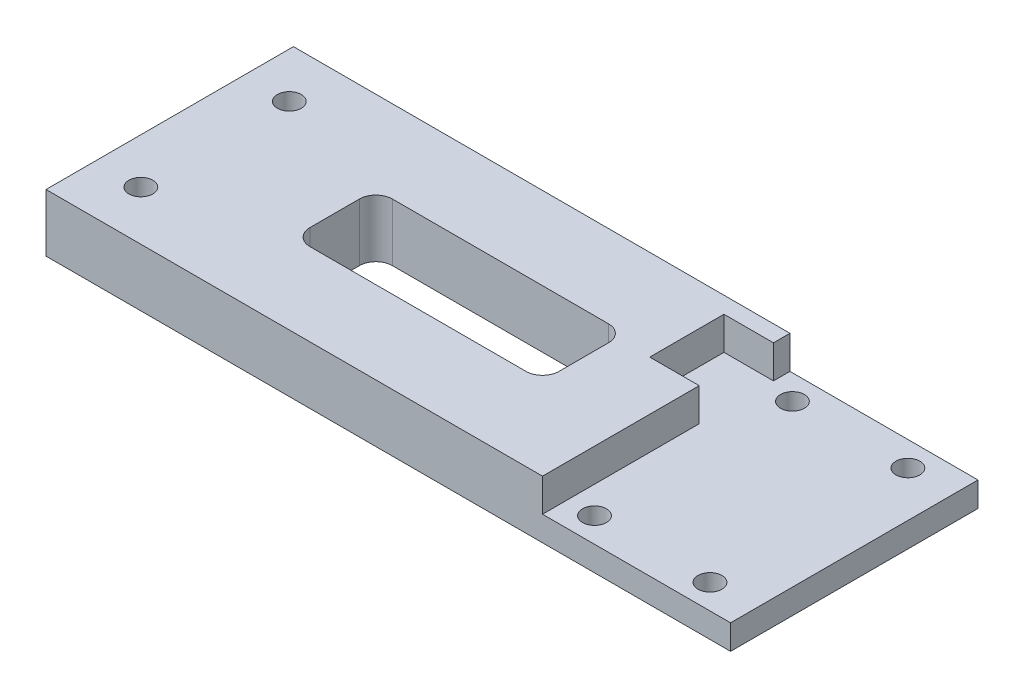
from build123d import *

# Parameters (mm, degrees)
SKETCH_1_W          = 88
SKETCH_1_H          = 30
EXTRUDE_1_DEPTH     = 3
SKETCH_2_W          = 27.8
SKETCH_2_H          = 30
CUT_EXTRUDE_1_DEPTH = 1
SKETCH_3_R          = 1.45
CUT_EXTRUDE_2_DEPTH = 11
SKETCH_4_R          = 1.45
CUT_EXTRUDE_4_DEPTH = 11
SKETCH_5_W          = 30.2
SKETCH_5_H          = 10
CUT_EXTRUDE_5_DEPTH = 11
FILLET_1_R          = 2
SKETCH_6_W          = 5
SKETCH_6_H          = 30
CUT_EXTRUDE_6_DEPTH = 10
SKETCH_9_W          = 60.2
SKETCH_9_H          = 30
SKETCH_9_R          = 1.45
EXTRUDE_4_DEPTH     = 4
EXTRUDE_START       = 1
SKETCH_7_W          = 22.8
SKETCH_7_H          = 30
SKETCH_7_R          = 1.45
EXTRUDE_5_DEPTH     = 1
SKETCH_11_W         = 15
SKETCH_11_H         = 4
CUT_EXTRUDE_8_DEPTH = 6
SKETCH_12_W         = 2
SKETCH_12_H         = 4
EXTRUDE_6_DEPTH     = 6
SKETCH_13_W         = 6
SKETCH_13_H         = 4
EXTRUDE_7_DEPTH     = 4
SKETCH_14_R         = 4
CUT_EXTRUDE_9_DEPTH = 4


with BuildPart() as part:
    # 草图1 → 凸台-拉伸1 (new body)
    with BuildSketch(Plane(origin=(0, 0, 0), x_dir=(1, 0, 0), z_dir=(0, 1, 0))):
        with Locations((-44, 15)):
            Rectangle(SKETCH_1_W, SKETCH_1_H)
    extrude(amount=EXTRUDE_1_DEPTH)

    # 草图2 → 切除-拉伸1 (cut)
    with BuildSketch(Plane(origin=(0, 3, 0), x_dir=(1, 0, 0), z_dir=(0, 1, 0))):
        with Locations((-13.9, 15)):
            Rectangle(SKETCH_2_W, SKETCH_2_H)
    extrude(amount=-CUT_EXTRUDE_1_DEPTH, mode=Mode.SUBTRACT)

    # 草图3 → 切除-拉伸2 (cut)
    with BuildSketch(Plane(origin=(0, 2, 0), x_dir=(1, 0, 0), z_dir=(0, 1, 0))):
        with Locations(Location((-24.5, 27, 0), (0, 0, 270))):
            Circle(SKETCH_3_R)
        with Locations(Location((-24.5, 3, 0), (0, 0, 270))):
            Circle(SKETCH_3_R)
        with Locations(Location((-10.5, 3, 0), (0, 0, 270))):
            Circle(SKETCH_3_R)
        with Locations(Location((-10.5, 27, 0), (0, 0, 270))):
            Circle(SKETCH_3_R)
    extrude(amount=-CUT_EXTRUDE_2_DEPTH, mode=Mode.SUBTRACT)

    # 草图4 → 切除-拉伸4 (cut)
    with BuildSketch(Plane(origin=(0, 3, 0), x_dir=(1, 0, 0), z_dir=(0, 1, 0))):
        with Locations(Location((-82.5, 24, 0), (0, 0, 270))):
            Circle(SKETCH_4_R)
        with Locations(Location((-82.5, 6, 0), (0, 0, 270))):
            Circle(SKETCH_4_R)
    extrude(amount=-CUT_EXTRUDE_4_DEPTH, mode=Mode.SUBTRACT)

    # 草图5 → 切除-拉伸5 (cut)
    with BuildSketch(Plane(origin=(0, 3, 0), x_dir=(1, 0, 0), z_dir=(0, 1, 0))):
        with Locations((-52.9, 15)):
            Rectangle(SKETCH_5_W, SKETCH_5_H)
    extrude(amount=-CUT_EXTRUDE_5_DEPTH, mode=Mode.SUBTRACT)

    # 圆角1
    fillet_1_edges = [part.edges().sort_by_distance(p)[0] for p in [
        (-68, 1.5, -10),
        (-68, 1.5, -20),
        (-37.8, 1.5, -20),
        (-37.8, 1.5, -10),
    ]]
    fillet(fillet_1_edges, radius=FILLET_1_R)

    # 草图6 → 切除-拉伸6 (cut)
    with BuildSketch(Plane.XZ):
        with Locations((-2.5, -15)):
            Rectangle(SKETCH_6_W, SKETCH_6_H)
    extrude(amount=-CUT_EXTRUDE_6_DEPTH, mode=Mode.SUBTRACT)

    # 草图9 → 凸台-拉伸4 (add)
    with BuildSketch(Plane(origin=(0, 3, 0), x_dir=(1, 0, 0), z_dir=(0, 1, 0))):
        with Locations((-57.9, 15)):
            Rectangle(SKETCH_9_W, SKETCH_9_H)
        with Locations(Location((-82.5, 6, 0), (0, 0, 270))):
            Circle(SKETCH_9_R, mode=Mode.SUBTRACT)
        with Locations(Location((-82.5, 24, 0), (0, 0, 270))):
            Circle(SKETCH_9_R, mode=Mode.SUBTRACT)
        with BuildLine():
            Line((-37.8, 12), (-37.8, 18))
            ThreePointArc((-37.8, 18), (-38.385786438, 19.414213562), (-39.8, 20))
            Line((-39.8, 20), (-66, 20))
            ThreePointArc((-66, 20), (-67.414213562, 19.414213562), (-68, 18))
            Line((-68, 18), (-68, 12))
            ThreePointArc((-68, 12), (-67.414213562, 10.585786438), (-66, 10))
            Line((-66, 10), (-39.8, 10))
            ThreePointArc((-39.8, 10), (-38.385786438, 10.585786438), (-37.8, 12))
        make_face(mode=Mode.SUBTRACT)
    extrude(amount=EXTRUDE_4_DEPTH)

    # 草图7 → 凸台-拉伸5 (add)
    with BuildSketch(Plane(origin=(0, 2, 0), x_dir=(1, 0, 0), z_dir=(0, 1, 0)).offset(EXTRUDE_START)):
        with Locations((-16.4, 15)):
            Rectangle(SKETCH_7_W, SKETCH_7_H)
        with Locations(Location((-10.5, 3, 0), (0, 0, 270))):
            Circle(SKETCH_7_R, mode=Mode.SUBTRACT)
        with Locations(Location((-24.5, 27, 0), (0, 0, 270))):
            Circle(SKETCH_7_R, mode=Mode.SUBTRACT)
        with Locations(Location((-10.5, 27, 0), (0, 0, 270))):
            Circle(SKETCH_7_R, mode=Mode.SUBTRACT)
        with Locations(Location((-24.5, 3, 0), (0, 0, 270))):
            Circle(SKETCH_7_R, mode=Mode.SUBTRACT)
    extrude(amount=-EXTRUDE_5_DEPTH)

    # 草图11 → 切除-拉伸8 (cut)
    with BuildSketch(Plane(origin=(-27.8, 0, 0), x_dir=(0, 0, -1), z_dir=(1, 0, 0))):
        with Locations((22.5, 5)):
            Rectangle(SKETCH_11_W, SKETCH_11_H)
    extrude(amount=-CUT_EXTRUDE_8_DEPTH, mode=Mode.SUBTRACT)

    # 草图12 → 凸台-拉伸6 (add)
    with BuildSketch(Plane(origin=(-33.8, 0, 0), x_dir=(0, 0, -1), z_dir=(1, 0, 0))):
        with Locations((29, 5)):
            Rectangle(SKETCH_12_W, SKETCH_12_H)
    extrude(amount=EXTRUDE_6_DEPTH)

    # 草图13 → 凸台-拉伸7 (add)
    with BuildSketch(Plane(origin=(0, 0, -15), x_dir=(-1, 0, 0), z_dir=(0, 0, -1))):
        with Locations((30.8, 5)):
            Rectangle(SKETCH_13_W, SKETCH_13_H)
    extrude(amount=EXTRUDE_7_DEPTH)

    # 草图14 → 切除-拉伸9 (cut)
    with BuildSketch(Plane.XZ):
        with Locations(Location((-82.5, -6, 0), (0, 0, 270))):
            Circle(SKETCH_14_R)
        with Locations(Location((-82.5, -24, 0), (0, 0, 270))):
            Circle(SKETCH_14_R)
    extrude(amount=-CUT_EXTRUDE_9_DEPTH, mode=Mode.SUBTRACT)


solid = part.part
